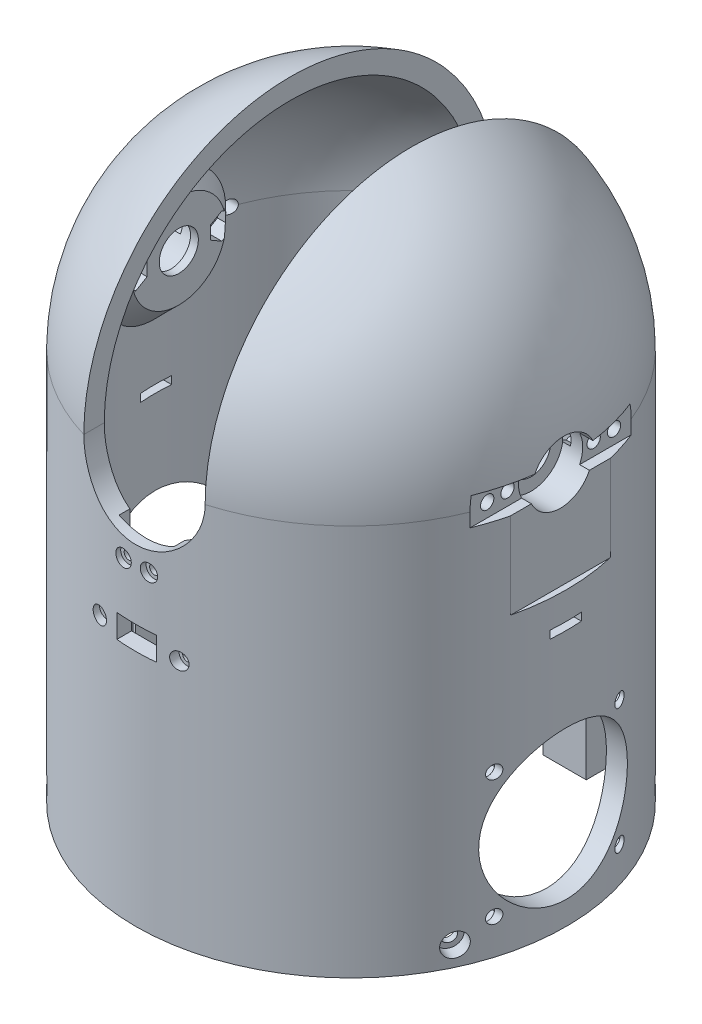
from build123d import *

# Parameters (mm, degrees)
CORTAR_EXTRUIR1_DEPTH      = 84
CORTAR_EXTRUIR1_DEPTH_BACK = 95
CROQUIS4_R                 = 5
CORTAR_EXTRUIR2_DEPTH      = 26
CROQUIS5_R                 = 8.2
CORTAR_EXTRUIR3_DEPTH      = 9
CROQUIS6_W                 = 50
CROQUIS6_H                 = 7
CORTAR_EXTRUIR4_DEPTH      = 4
CROQUIS7_R                 = 1.7
CORTAR_EXTRUIR5_DEPTH      = 10
CORTAR_EXTRUIR6_DEPTH      = 4
SALIENTE_EXTRUIR1_DEPTH    = 55
CORTAR_EXTRUIR7_DEPTH      = 55
MATRIZC1_COUNT             = 2
CROQUIS11_R                = 1.7
CORTAR_EXTRUIR8_DEPTH      = 10
CROQUIS12_R                = 2.95
CORTAR_EXTRUIR9_DEPTH      = 3.35
MATRIZC2_COUNT             = 2
MATRIZC2_ANGLE             = 290
MATRIZC3_COUNT             = 2
MATRIZC3_COPY_1_SKETCH_R   = 1.7
MATRIZC3_COPY_1_DEPTH      = 10
MATRIZC3_COPY_2_SKETCH_R   = 2.95
MATRIZC3_COPY_2_DEPTH      = 3.35
CROQUIS13_W                = 14
CROQUIS13_H                = 30
CORTAR_EXTRUIR10_DEPTH     = 52.25
CROQUIS14_R                = 1.2
CORTAR_EXTRUIR11_DEPTH     = 7.25
CROQUIS15_R                = 2.1
CORTAR_EXTRUIR12_DEPTH     = 1.5
CROQUIS16_W                = 27
CROQUIS16_H                = 12
CORTAR_EXTRUIR13_DEPTH     = 51
CROQUIS17_R                = 1.2
CROQUIS17_W                = 10.15
CROQUIS17_H                = 6
CORTAR_EXTRUIR14_DEPTH     = 6
CROQUIS18_R                = 2.1
CORTAR_EXTRUIR15_DEPTH     = 3
CROQUIS19_R                = 1.7
CROQUIS19_R_2              = 19
CORTAR_EXTRUIR16_DEPTH     = 11
CORTAR_EXTRUIR17_DEPTH     = 51
CORTAR_EXTRUIR18_DEPTH     = 1.5
CROQUIS22_W                = 8
CROQUIS22_H                = 2
CORTAR_EXTRUIR19_DEPTH     = 10


with BuildPart() as part:
    # Croquis1 → Revolución1 (revolve)
    with BuildSketch(Plane.XY, mode=Mode.PRIVATE) as revoluci_n1_sk:
        with BuildLine():
            Line((50, 100), (50, 0))
            Line((50, 0), (55, 0))
            Line((55, 0), (55, 100))
            ThreePointArc((55, 100), (38.890872965, 138.890872965), (0, 155))
            Line((0, 155), (0, 150))
            ThreePointArc((0, 150), (35.355339059, 135.355339059), (50, 100))
        make_face()
    revolve(revoluci_n1_sk.sketch.rotate(Axis((0, 176.429466528, 0), (0, -1, 0)), 90), axis=Axis((0, 176.429466528, 0), (0, -1, 0)))

    # Croquis2 → Cortar-Extruir1 (cut, two sides: drawn at the far end of the back side and taken through both)
    with BuildSketch(Plane.XY.offset(-CORTAR_EXTRUIR1_DEPTH_BACK)):
        with BuildLine():
            Line((15.5, 100), (15.5, 160))
            Line((15.5, 160), (-15.5, 160))
            Line((-15.5, 160), (-15.5, 100))
            ThreePointArc((-15.5, 100), (0, 84.5), (15.5, 100))
        make_face()
    extrude(amount=CORTAR_EXTRUIR1_DEPTH + CORTAR_EXTRUIR1_DEPTH_BACK, mode=Mode.SUBTRACT)

    # Croquis3 → Revolución2 (revolve)
    with BuildSketch(Plane.XY, mode=Mode.PRIVATE) as revoluci_n2_sk:
        Polygon((-50, 118), (-50, 100), (-44, 100), (-44, 112), align=None)
    revoluci_n2 = revolve(revoluci_n2_sk.sketch.rotate(Axis((-69.509607383, 100, 0), (1, 0, 0)), 90), axis=Axis((-69.509607383, 100, 0), (1, 0, 0)))

    # Croquis4 → Cortar-Extruir2 (cut)
    with BuildSketch(Plane(origin=(-44, 0, 0), x_dir=(0, 0, -1), z_dir=(1, 0, 0))):
        with Locations((0, 100)):
            Circle(CROQUIS4_R)
    cortar_extruir2 = extrude(amount=-CORTAR_EXTRUIR2_DEPTH, mode=Mode.SUBTRACT)

    # Croquis5 → Cortar-Extruir3 (cut)
    with BuildSketch(Plane.ZY.offset(55)):
        with Locations((0, 100)):
            Circle(CROQUIS5_R)
    cortar_extruir3 = extrude(amount=-CORTAR_EXTRUIR3_DEPTH, mode=Mode.SUBTRACT)

    # Croquis6 → Cortar-Extruir4 (cut)
    with BuildSketch(Plane.ZY.offset(55)):
        with Locations((0, 100)):
            Rectangle(CROQUIS6_W, CROQUIS6_H)
    cortar_extruir4 = extrude(amount=-CORTAR_EXTRUIR4_DEPTH, mode=Mode.SUBTRACT)

    # Croquis7 → Cortar-Extruir5 (cut)
    with BuildSketch(Plane.ZY.offset(51)):
        with Locations((-11, 100)):
            Circle(CROQUIS7_R)
        with Locations((11, 100)):
            Circle(CROQUIS7_R)
        with Locations((16.2, 100)):
            Circle(CROQUIS7_R)
        with Locations(Location((-16.2, 100, 0), (0, 0, 180))):
            Circle(CROQUIS7_R)
    cortar_extruir5 = extrude(amount=-CORTAR_EXTRUIR5_DEPTH, mode=Mode.SUBTRACT)

    # Croquis8 → Cortar-Extruir6 (cut)
    with BuildSketch(Plane(origin=(-44, 0, 0), x_dir=(0, 0, -1), z_dir=(1, 0, 0))):
        Polygon((-11, 96.65), (-8.098814897, 98.325), (-8.098814897, 101.675), (-11, 103.35), (-13.901185103, 101.675), (-13.901185103, 98.325), align=None)
        Polygon((11, 96.65), (13.901185103, 98.325), (13.901185103, 101.675), (11, 103.35), (8.098814897, 101.675), (8.098814897, 98.325), align=None)
    cortar_extruir6 = extrude(amount=-CORTAR_EXTRUIR6_DEPTH, mode=Mode.SUBTRACT)

    # Simetría1: Revolución2, Cortar-Extruir2, Cortar-Extruir3, Cortar-Extruir4, Cortar-Extruir5, Cortar-Extruir6 across plane
    add(revoluci_n2.mirror(Plane(origin=(0, 0, 0), x_dir=(0, 0, 1), z_dir=(1, 0, 0))))
    add(cortar_extruir2.mirror(Plane(origin=(0, 0, 0), x_dir=(0, 0, 1), z_dir=(1, 0, 0))), mode=Mode.SUBTRACT)
    add(cortar_extruir3.mirror(Plane(origin=(0, 0, 0), x_dir=(0, 0, 1), z_dir=(1, 0, 0))), mode=Mode.SUBTRACT)
    add(cortar_extruir4.mirror(Plane(origin=(0, 0, 0), x_dir=(0, 0, 1), z_dir=(1, 0, 0))), mode=Mode.SUBTRACT)
    add(cortar_extruir5.mirror(Plane(origin=(0, 0, 0), x_dir=(0, 0, 1), z_dir=(1, 0, 0))), mode=Mode.SUBTRACT)
    add(cortar_extruir6.mirror(Plane(origin=(0, 0, 0), x_dir=(0, 0, 1), z_dir=(1, 0, 0))), mode=Mode.SUBTRACT)

    # Croquis9 → Saliente-Extruir1 (add)
    with BuildSketch(Plane.XZ):
        with BuildLine():
            Line((-38.9, -27), (-27.9, -27))
            Line((-27.9, -27), (-27.9, -41.492047431))
            ThreePointArc((-27.9, -41.492047431), (-33.778036088, -36.865217727), (-38.9, -31.41321378))
            Line((-38.9, -31.41321378), (-38.9, -27))
        make_face()
        with BuildLine():
            Line((14.1, -35), (25.1, -35))
            Line((25.1, -35), (25.1, -43.243380996))
            ThreePointArc((25.1, -43.243380996), (19.742009373, -45.937490854), (14.1, -47.970720236))
            Line((14.1, -47.970720236), (14.1, -35))
        make_face()
    saliente_extruir1 = extrude(amount=-SALIENTE_EXTRUIR1_DEPTH)

    # Croquis10 → Cortar-Extruir7 (cut)
    with BuildSketch(Plane.XZ):
        Polygon((-27.9, -41.492047431), (-21.056531053, -41.492047431), (-21.056531053, -45.35), (-24.1, -45.35), (-27.9, -43), align=None)
        Polygon((-32, -29.5), (-32, -39.5), (-26.041232037, -34.5), align=None)
        Polygon((18.2, -37.5), (18.2, -47.5), (12.241232037, -42.5), align=None)
    cortar_extruir7 = extrude(amount=-CORTAR_EXTRUIR7_DEPTH, mode=Mode.SUBTRACT)

    # MatrizC1: Saliente-Extruir1, Cortar-Extruir7 ×2 about axis
    matrizc1_axis = Axis((0, 0, 0), (0, 1, 0))
    add([saliente_extruir1.rotate(matrizc1_axis, i * 360 / MATRIZC1_COUNT) for i in range(1, MATRIZC1_COUNT)])
    add([cortar_extruir7.rotate(matrizc1_axis, i * 360 / MATRIZC1_COUNT) for i in range(1, MATRIZC1_COUNT)], mode=Mode.SUBTRACT)

    # Croquis11 → Cortar-Extruir8 (cut)
    with BuildSketch(Plane(origin=(-38.890872965, 0, 38.890872965), x_dir=(0, 1, 0), z_dir=(-0.7071067811865464, 0, 0.7071067811865488))):
        with Locations(Location((5, 0, 0), (0, 0, 270))):
            Circle(CROQUIS11_R)
    cortar_extruir8 = extrude(amount=-CORTAR_EXTRUIR8_DEPTH, mode=Mode.SUBTRACT)

    # Croquis12 → Cortar-Extruir9 (cut)
    with BuildSketch(Plane(origin=(-38.890872965, 0, 38.890872965), x_dir=(0, 1, 0), z_dir=(-0.7071067811865464, 0, 0.7071067811865488))):
        with Locations(Location((5, 0, 0), (0, 0, 270))):
            Circle(CROQUIS12_R)
    cortar_extruir9 = extrude(amount=-CORTAR_EXTRUIR9_DEPTH, mode=Mode.SUBTRACT)

    # MatrizC2: Cortar-Extruir8, Cortar-Extruir9 ×2 about axis
    matrizc2_axis = Axis((0, 0, 0), (0, 1, 0))
    add([cortar_extruir8.rotate(matrizc2_axis, i * MATRIZC2_ANGLE / (MATRIZC2_COUNT - 1)) for i in range(1, MATRIZC2_COUNT)], mode=Mode.SUBTRACT)
    add([cortar_extruir9.rotate(matrizc2_axis, i * MATRIZC2_ANGLE / (MATRIZC2_COUNT - 1)) for i in range(1, MATRIZC2_COUNT)], mode=Mode.SUBTRACT)

    # MatrizC3: Cortar-Extruir8, Cortar-Extruir9 ×2 about axis
    matrizc3_axis = Axis((0, 0, 0), (0, 1, 0))
    add([cortar_extruir8.rotate(matrizc3_axis, i * 360 / MATRIZC3_COUNT) for i in range(1, MATRIZC3_COUNT)], mode=Mode.SUBTRACT)
    add([cortar_extruir9.rotate(matrizc3_axis, i * 360 / MATRIZC3_COUNT) for i in range(1, MATRIZC3_COUNT)], mode=Mode.SUBTRACT)

    # MatrizC3 copy 1 sketch → MatrizC3 copy 1 (cut)
    with BuildSketch(Plane(origin=(49.846928287, 0, 23.244004396), x_dir=(0, 1, 0), z_dir=(0.9063077870366553, 0, 0.42261826174068806))):
        with Locations(Location((5, 0, 0), (0, 0, 270))):
            Circle(MATRIZC3_COPY_1_SKETCH_R)
    extrude(amount=-MATRIZC3_COPY_1_DEPTH, mode=Mode.SUBTRACT)

    # MatrizC3 copy 2 sketch → MatrizC3 copy 2 (cut)
    with BuildSketch(Plane(origin=(49.846928287, 0, 23.244004396), x_dir=(0, 1, 0), z_dir=(0.9063077870366553, 0, 0.42261826174068806))):
        with Locations(Location((5, 0, 0), (0, 0, 270))):
            Circle(MATRIZC3_COPY_2_SKETCH_R)
    extrude(amount=-MATRIZC3_COPY_2_DEPTH, mode=Mode.SUBTRACT)

    # Croquis13 → Cortar-Extruir10 (cut)
    with BuildSketch(Plane.XY):
        with Locations((0, 87)):
            Rectangle(CROQUIS13_W, CROQUIS13_H)
    extrude(amount=CORTAR_EXTRUIR10_DEPTH, mode=Mode.SUBTRACT)

    # Croquis14 → Cortar-Extruir11 (cut)
    with BuildSketch(Plane(origin=(0, 0, 52.25), x_dir=(-1, 0, 0), z_dir=(0, 0, -1))):
        with Locations((-3.25, 79.9)):
            Circle(CROQUIS14_R)
        with Locations((3.25, 79.9)):
            Circle(CROQUIS14_R)
    extrude(amount=-CORTAR_EXTRUIR11_DEPTH, mode=Mode.SUBTRACT)

    # Croquis15 → Cortar-Extruir12 (cut)
    with BuildSketch(Plane.XY.offset(55)):
        with Locations((-3.25, 79.9)):
            Circle(CROQUIS15_R)
        with Locations((3.25, 79.9)):
            Circle(CROQUIS15_R)
    extrude(amount=-CORTAR_EXTRUIR12_DEPTH, mode=Mode.SUBTRACT)

    # Croquis16 → Cortar-Extruir13 (cut)
    with BuildSketch(Plane.XY):
        with Locations((0, 63.375)):
            Rectangle(CROQUIS16_W, CROQUIS16_H)
    extrude(amount=CORTAR_EXTRUIR13_DEPTH, mode=Mode.SUBTRACT)

    # Croquis17 → Cortar-Extruir14 (cut)
    with BuildSketch(Plane(origin=(0, 0, 51), x_dir=(-1, 0, 0), z_dir=(0, 0, -1))):
        with Locations((-10.16, 63.375)):
            Circle(CROQUIS17_R)
        with Locations((10.16, 63.375)):
            Circle(CROQUIS17_R)
        with Locations((0, 63.875)):
            Rectangle(CROQUIS17_W, CROQUIS17_H)
    extrude(amount=-CORTAR_EXTRUIR14_DEPTH, mode=Mode.SUBTRACT)

    # Croquis18 → Cortar-Extruir15 (cut)
    with BuildSketch(Plane.XY.offset(55)):
        with Locations((-10.16, 63.375)):
            Circle(CROQUIS18_R)
        with Locations((10.16, 63.375)):
            Circle(CROQUIS18_R)
    extrude(amount=-CORTAR_EXTRUIR15_DEPTH, mode=Mode.SUBTRACT)

    # Croquis19 → Cortar-Extruir16 (cut)
    with BuildSketch(Plane.ZY.offset(55)):
        with Locations((-16, 41)):
            Circle(CROQUIS19_R)
        with Locations((16, 41)):
            Circle(CROQUIS19_R)
        with Locations((-16, 9)):
            Circle(CROQUIS19_R)
        with Locations((16, 9)):
            Circle(CROQUIS19_R)
        with Locations((0, 25)):
            Circle(CROQUIS19_R_2)
    cortar_extruir16 = extrude(amount=-CORTAR_EXTRUIR16_DEPTH, mode=Mode.SUBTRACT)

    # Croquis20 → Cortar-Extruir17 (cut)
    with BuildSketch(Plane(origin=(0, 0, 0), x_dir=(0, 0, -1), z_dir=(1, 0, 0))):
        Polygon((-16, 37.65), (-13.098814897, 39.325), (-13.098814897, 42.675), (-16, 44.35), (-18.901185103, 42.675), (-18.901185103, 39.325), align=None)
        Polygon((16, 37.65), (18.901185103, 39.325), (18.901185103, 42.675), (16, 44.35), (13.098814897, 42.675), (13.098814897, 39.325), align=None)
        Polygon((16, 5.65), (18.901185103, 7.325), (18.901185103, 10.675), (16, 12.35), (13.098814897, 10.675), (13.098814897, 7.325), align=None)
        Polygon((-16, 5.65), (-13.098814897, 7.325), (-13.098814897, 10.675), (-16, 12.35), (-18.901185103, 10.675), (-18.901185103, 7.325), align=None)
    cortar_extruir17 = extrude(amount=-CORTAR_EXTRUIR17_DEPTH, mode=Mode.SUBTRACT)

    # Simetría2: Cortar-Extruir16, Cortar-Extruir17 across plane
    add(cortar_extruir16.mirror(Plane(origin=(0, 0, 0), x_dir=(0, 0, 1), z_dir=(1, 0, 0))), mode=Mode.SUBTRACT)
    add(cortar_extruir17.mirror(Plane(origin=(0, 0, 0), x_dir=(0, 0, 1), z_dir=(1, 0, 0))), mode=Mode.SUBTRACT)

    # Croquis21 → Cortar-Extruir18 (cut)
    with BuildSketch(Plane.ZY.offset(55)):
        with BuildLine():
            Line((-16.25, 96.5), (-3.570714214, 96.5))
            ThreePointArc((-3.570714214, 96.5), (0, 95), (3.570714214, 96.5))
            Line((3.570714214, 96.5), (16.25, 96.5))
            Line((16.25, 96.5), (16.25, 74.5))
            Line((16.25, 74.5), (-16.25, 74.5))
            Line((-16.25, 74.5), (-16.25, 96.5))
        make_face()
    cortar_extruir18 = extrude(amount=-CORTAR_EXTRUIR18_DEPTH, mode=Mode.SUBTRACT)

    # Croquis22 → Cortar-Extruir19 (cut)
    with BuildSketch(Plane.ZY.offset(55)):
        with Locations((0, 66.5)):
            Rectangle(CROQUIS22_W, CROQUIS22_H)
    cortar_extruir19 = extrude(amount=-CORTAR_EXTRUIR19_DEPTH, mode=Mode.SUBTRACT)

    # Simetría3: Cortar-Extruir18, Cortar-Extruir19 across plane
    add(cortar_extruir18.mirror(Plane(origin=(0, 0, 0), x_dir=(0, 0, 1), z_dir=(1, 0, 0))), mode=Mode.SUBTRACT)
    add(cortar_extruir19.mirror(Plane(origin=(0, 0, 0), x_dir=(0, 0, 1), z_dir=(1, 0, 0))), mode=Mode.SUBTRACT)


solid = part.part
